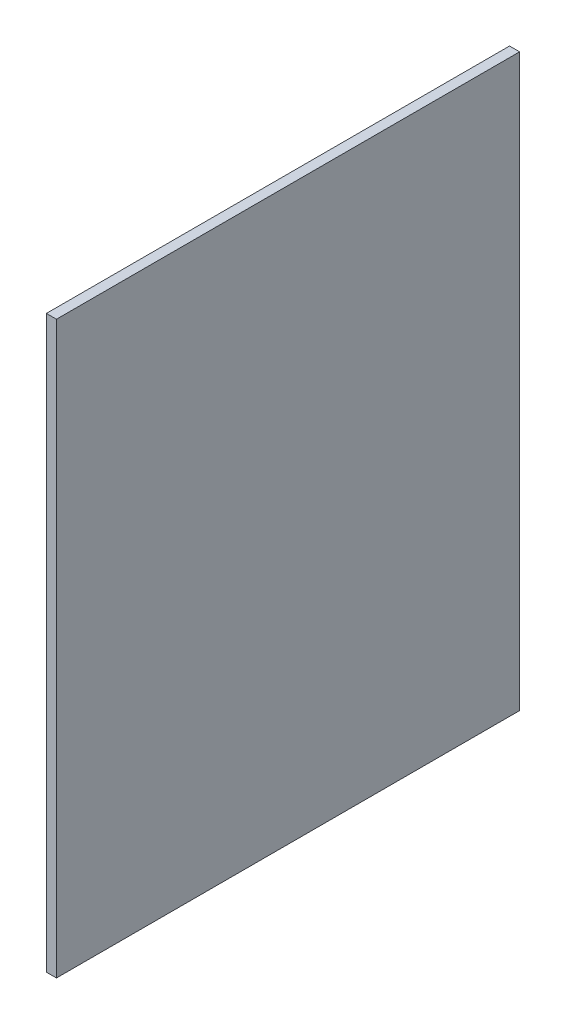
from build123d import *

# Parameters (mm, degrees)
SKETCH1_W           = 876.3
SKETCH1_H           = 1079.5
BOSS_EXTRUDE1_DEPTH = 19.05


with BuildPart() as part:
    # Sketch1 → Boss-Extrude1 (new body)
    with BuildSketch(Plane(origin=(0, 0, 0), x_dir=(0, 0, -1), z_dir=(1, 0, 0))):
        with Locations((401.663013271, 490.67500285)):
            Rectangle(SKETCH1_W, SKETCH1_H)
    extrude(amount=BOSS_EXTRUDE1_DEPTH)


solid = part.part
